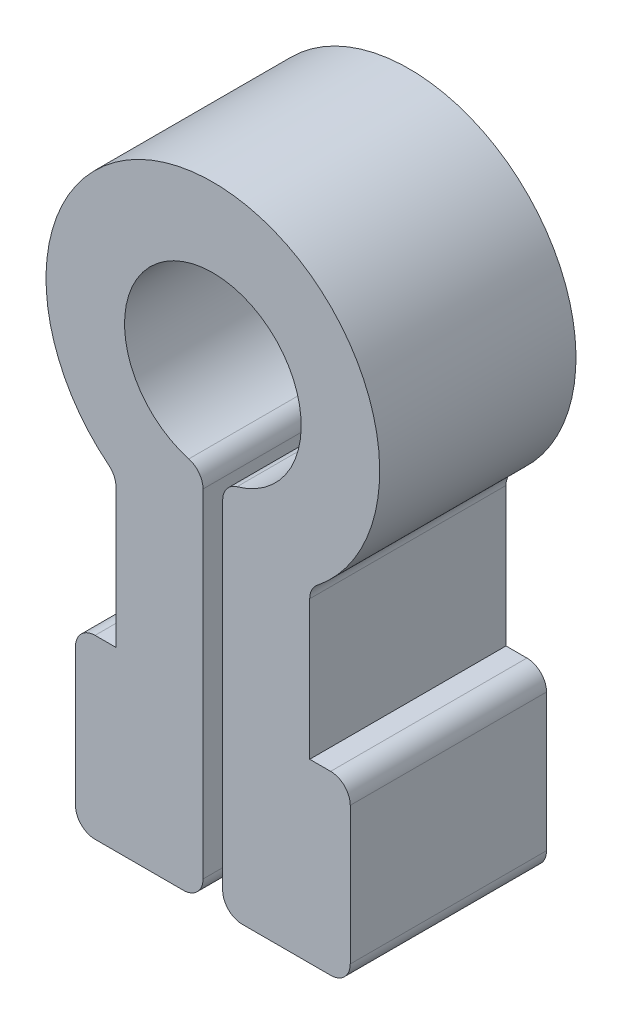
from build123d import *

# Parameters (mm, degrees)
SALIENTE_EXTRUIR1_DEPTH = 10


with BuildPart() as part:
    # Croquis1 → Saliente-Extruir1 (new body)
    with BuildSketch(Plane.XY):
        with BuildLine():
            Line((1.5, -23.5), (6, -23.5))
            ThreePointArc((6, -23.5), (6.707106781, -23.207106781), (7, -22.5))
            Line((7, -22.5), (7, -15.5))
            ThreePointArc((7, -15.5), (6.707106781, -14.792893219), (6, -14.5))
            Line((6, -14.5), (4.934593139, -14.5))
            Line((4.934593139, -14.5), (4.934593139, -7.41826154))
            ThreePointArc((4.934593139, -7.41826154), (5.033290189, -6.985072213), (5.309899124, -6.637391904))
            ThreePointArc((5.309899124, -6.637391904), (0, 8.5), (-5.309899124, -6.637391904))
            ThreePointArc((-5.309899124, -6.637391904), (-5.033290189, -6.985072213), (-4.934593139, -7.41826154))
            Line((-4.934593139, -7.41826154), (-4.934593139, -14.5))
            Line((-4.934593139, -14.5), (-6, -14.5))
            ThreePointArc((-6, -14.5), (-6.707106781, -14.792893219), (-7, -15.5))
            Line((-7, -15.5), (-7, -22.5))
            ThreePointArc((-7, -22.5), (-6.707106781, -23.207106781), (-6, -23.5))
            Line((-6, -23.5), (-1.5, -23.5))
            ThreePointArc((-1.5, -23.5), (-0.792893219, -23.207106781), (-0.5, -22.5))
            Line((-0.5, -22.5), (-0.5, -5.291502622))
            ThreePointArc((-0.5, -5.291502622), (-0.702275965, -4.688479933), (-1.227272727, -4.329411236))
            ThreePointArc((-1.227272727, -4.329411236), (0, 4.5), (1.227272727, -4.329411236))
            ThreePointArc((1.227272727, -4.329411236), (0.702275965, -4.688479933), (0.5, -5.291502622))
            Line((0.5, -5.291502622), (0.5, -22.5))
            ThreePointArc((0.5, -22.5), (0.792893219, -23.207106781), (1.5, -23.5))
        make_face()
    extrude(amount=SALIENTE_EXTRUIR1_DEPTH)


solid = part.part
